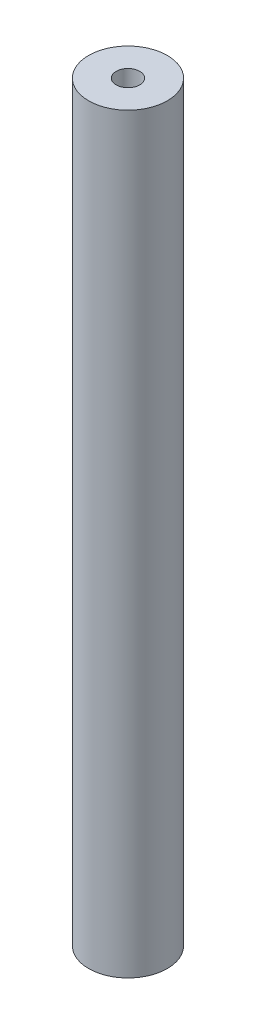
from build123d import *

# Parameters (mm, degrees)
SKETCH1_R           = 3
SKETCH1_R_2         = 0.9
BOSS_EXTRUDE1_DEPTH = 57.33


with BuildPart() as part:
    # Sketch1 → Boss-Extrude1 (new body)
    with BuildSketch(Plane(origin=(0, 0, 0), x_dir=(1, 0, 0), z_dir=(0, 1, 0))):
        with Locations(Location((0, 0, 0), (0, 0, 270))):
            Circle(SKETCH1_R)
        with Locations(Location((0, 0, 0), (0, 0, 270))):
            Circle(SKETCH1_R_2, mode=Mode.SUBTRACT)
    extrude(amount=BOSS_EXTRUDE1_DEPTH)


solid = part.part
